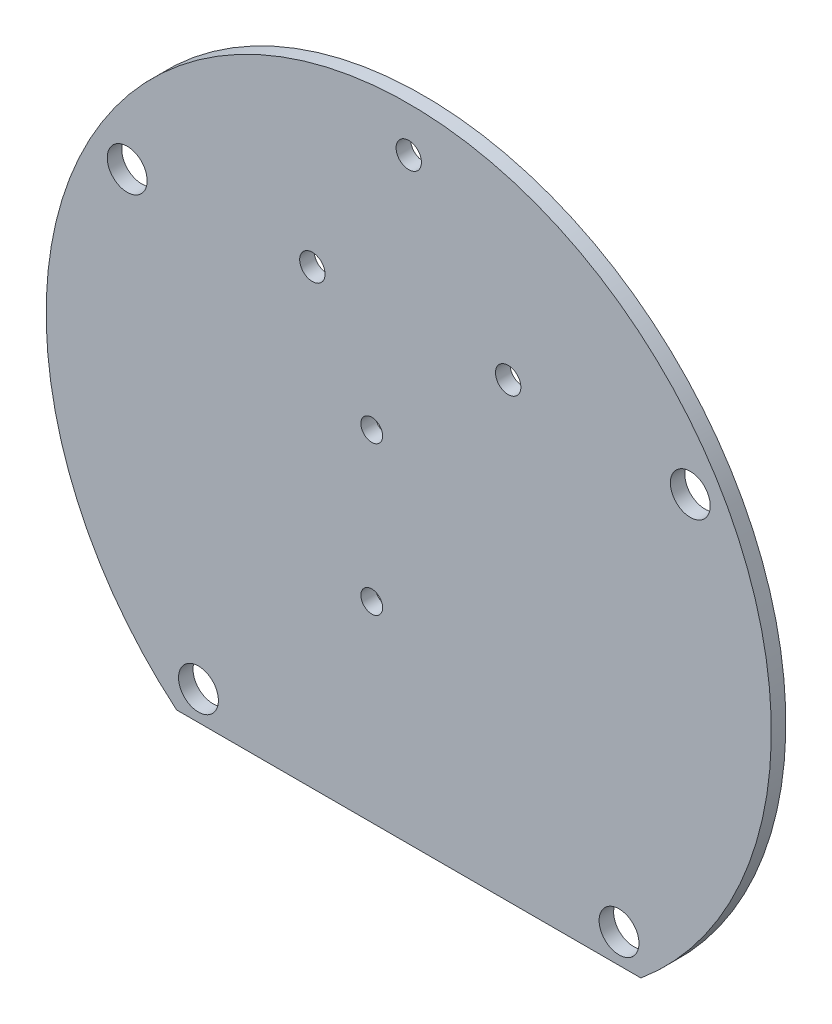
from build123d import *

# Parameters (mm, degrees)
ESBO_O1_R                  = 50
RESSALTO_EXTRUS_O1_DEPTH   = 2
ESBO_O2_R                  = 2.75
CORTE_EXTRUS_O1_DEPTH      = 2
CORTE_EXTRUS_O2_DEPTH      = 71.738956735
CORTE_EXTRUS_O2_DEPTH_BACK = 10
ESBO_O5_R                  = 1.5
ESBO_O5_R_2                = 1.75
CORTE_EXTRUS_O3_DEPTH      = 10


with BuildPart() as part:
    # Esboço1 → Ressalto-extrusão1 (new body)
    with BuildSketch(Plane.XY):
        Circle(ESBO_O1_R)
    extrude(amount=RESSALTO_EXTRUS_O1_DEPTH)

    # Esboço2 → Corte-extrusão1 (cut)
    with BuildSketch(Plane.XY.offset(2)):
        with Locations((-29, -34.409301068)):
            Circle(ESBO_O2_R)
        with Locations((29, -34.409301068)):
            Circle(ESBO_O2_R)
        with Locations((-38.824197531, 22.752619324)):
            Circle(ESBO_O2_R)
        with Locations((38.824197531, 22.752619324)):
            Circle(ESBO_O2_R)
    extrude(amount=-CORTE_EXTRUS_O1_DEPTH, mode=Mode.SUBTRACT)

    # Esboço4 → Corte-extrusão2 (cut, two sides: drawn at the far end of the back side and taken through both)
    with BuildSketch(Plane.XY.offset(2).offset(-CORTE_EXTRUS_O2_DEPTH_BACK)):
        Polygon((-40.723859979, -38.409301068), (44.57073926, -38.409301068), (1.923439641, -68.002213614), align=None)
    extrude(amount=CORTE_EXTRUS_O2_DEPTH + CORTE_EXTRUS_O2_DEPTH_BACK, mode=Mode.SUBTRACT)

    # Esboço5 → Corte-extrusão3 (cut)
    with BuildSketch(Plane(origin=(0, 0, 0), x_dir=(-1, 0, 0), z_dir=(0, 0, -1))):
        with Locations((5.1, 8.5)):
            Circle(ESBO_O5_R)
        with Locations((5.1, -12)):
            Circle(ESBO_O5_R)
        with Locations((-13.71, 23.86)):
            Circle(ESBO_O5_R_2)
        with Locations((13.29, 23.86)):
            Circle(ESBO_O5_R_2)
        with Locations((0, 43.86)):
            Circle(ESBO_O5_R_2)
    extrude(amount=-CORTE_EXTRUS_O3_DEPTH, mode=Mode.SUBTRACT)


solid = part.part
